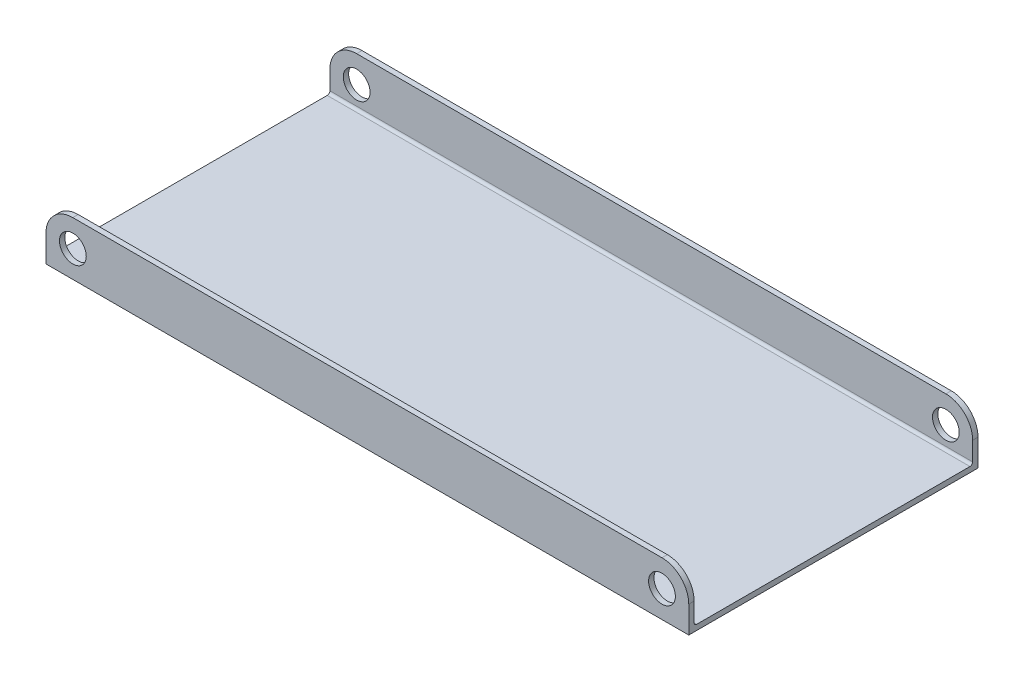
from build123d import *

# Parameters (mm, degrees)
SKETCH1_W           = 152.4
SKETCH1_H           = 1.27
BOSS_EXTRUDE1_DEPTH = 12.7
SKETCH1_3_W         = 152.4
SKETCH1_3_H         = 66.04
BOSS_EXTRUDE2_DEPTH = 1.27
SKETCH2_R           = 3.175
CUT_EXTRUDE1_DEPTH  = 508
SKETCH1_5_W         = 152.4
SKETCH1_5_H         = 1.27
BOSS_EXTRUDE3_DEPTH = 12.7
CUT_EXTRUDE2_START  = -12.7
SKETCH3_R           = 3.175
CUT_EXTRUDE2_DEPTH  = 12.7
FILLET1_R           = 6.35
FILLET2_R           = 0.635


with BuildPart() as part:
    # Sketch1 → Boss-Extrude1 (new body)
    with BuildSketch(Plane(origin=(0, 0, 0), x_dir=(1, 0, 0), z_dir=(0, 1, 0))):
        with Locations((76.2, 0.635)):
            Rectangle(SKETCH1_W, SKETCH1_H)
    extrude(amount=BOSS_EXTRUDE1_DEPTH)

    # Sketch1<3> → Boss-Extrude2 (add)
    with BuildSketch(Plane(origin=(0, 0, 0), x_dir=(1, 0, 0), z_dir=(0, 1, 0))):
        with Locations((76.2, 34.29)):
            Rectangle(SKETCH1_3_W, SKETCH1_3_H)
    extrude(amount=BOSS_EXTRUDE2_DEPTH)

    # Sketch2 → Cut-Extrude1 (cut)
    with BuildSketch(Plane.XY):
        with Locations((6.37364392, 6.35)):
            Circle(SKETCH2_R)
        with Locations((146.05, 6.35)):
            Circle(SKETCH2_R)
    extrude(amount=-CUT_EXTRUDE1_DEPTH, mode=Mode.SUBTRACT)

    # Sketch1<5> → Boss-Extrude3 (add)
    with BuildSketch(Plane(origin=(0, 0, 0), x_dir=(1, 0, 0), z_dir=(0, 1, 0))):
        with Locations((76.2, 67.945)):
            Rectangle(SKETCH1_5_W, SKETCH1_5_H)
    extrude(amount=BOSS_EXTRUDE3_DEPTH)

    # Sketch3 → Cut-Extrude2 (cut)
    with BuildSketch(Plane(origin=(0, 0, -68.58), x_dir=(-1, 0, 0), z_dir=(0, 0, -1)).offset(CUT_EXTRUDE2_START)):
        with Locations((-6.35, 6.35)):
            Circle(SKETCH3_R)
        with Locations((-146.05, 6.35)):
            Circle(SKETCH3_R)
    extrude(amount=CUT_EXTRUDE2_DEPTH, mode=Mode.SUBTRACT)

    # Fillet1
    fillet1_edges = [part.edges().sort_by_distance(p)[0] for p in [
        (0, 12.7, -0.635),
        (152.4, 12.7, -0.635),
        (152.4, 12.7, -67.945),
        (0, 12.7, -67.945),
    ]]
    fillet(fillet1_edges, radius=FILLET1_R)

    # Fillet2
    fillet2_edges = [part.edges().sort_by_distance(p)[0] for p in [
        (76.2, 1.27, -1.27),
        (76.2, 1.27, -67.31),
    ]]
    fillet(fillet2_edges, radius=FILLET2_R)


solid = part.part
